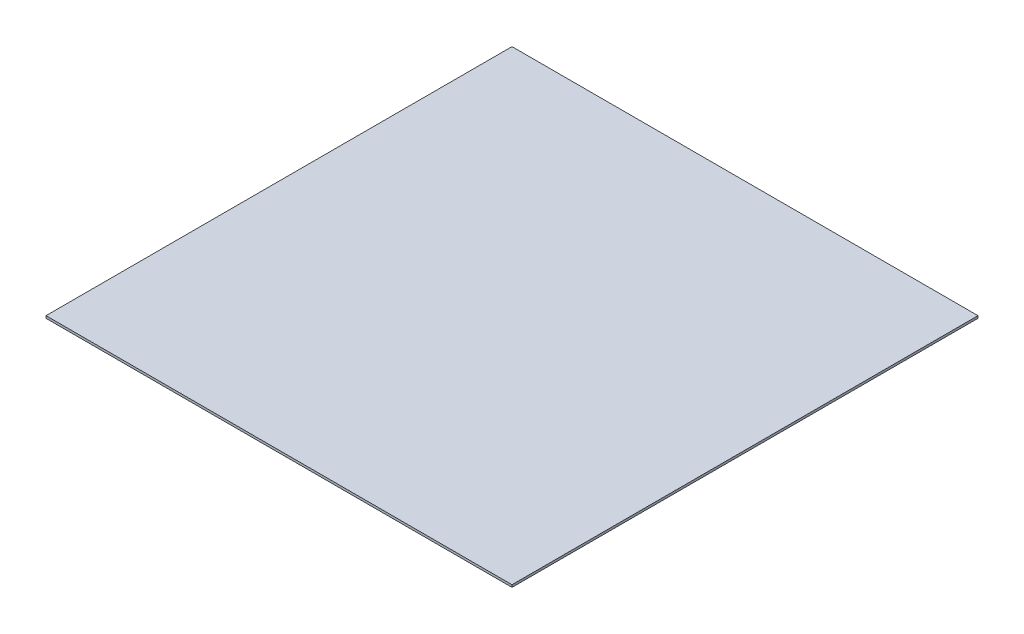
from build123d import *

# Parameters (mm, degrees)
ESQUISSE1_W        = 2000
ESQUISSE1_H        = 2000
BOSS_EXTRU_1_DEPTH = 10


with BuildPart() as part:
    # Esquisse1 → Boss.-Extru.1 (new body)
    with BuildSketch(Plane(origin=(0, 0, 0), x_dir=(1, 0, 0), z_dir=(0, 1, 0))):
        with Locations((-1000, -1000)):
            Rectangle(ESQUISSE1_W, ESQUISSE1_H)
    extrude(amount=BOSS_EXTRU_1_DEPTH)


solid = part.part
